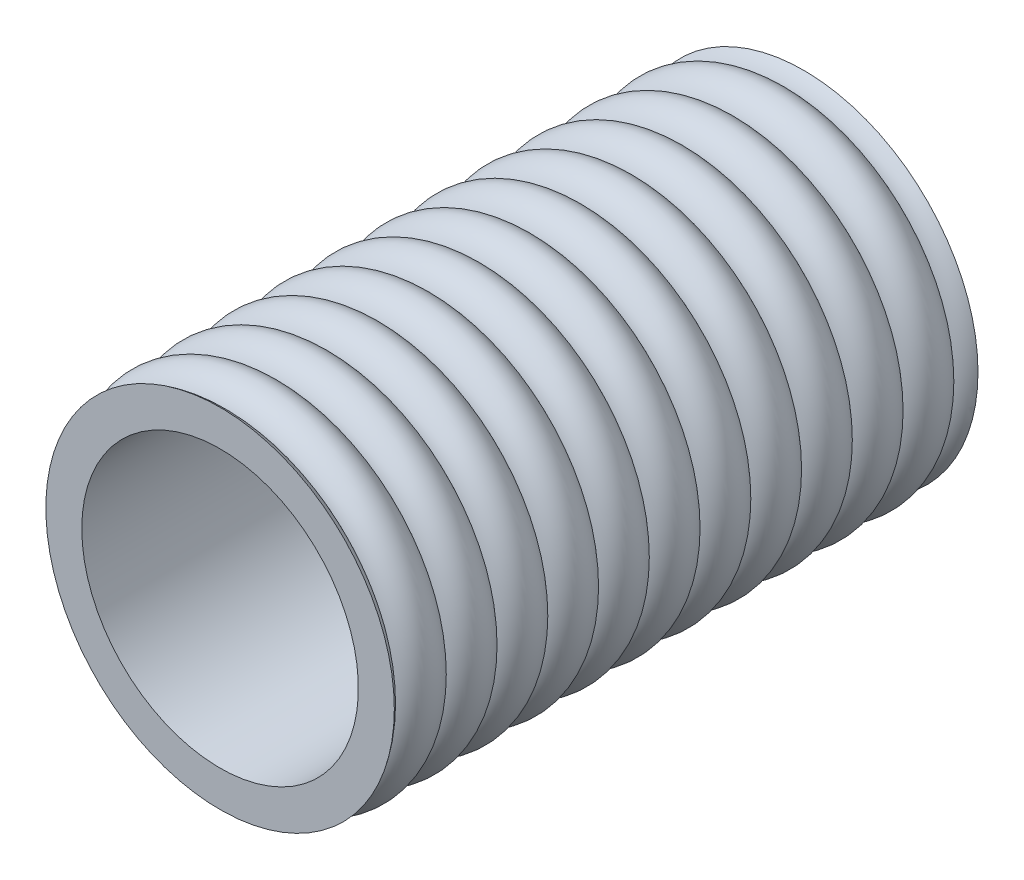
from build123d import *

# Parameters (mm, degrees)
SKETCH1_R           = 7
BOSS_EXTRUDE1_DEPTH = 23
SKETCH2_R           = 5.4
CUT_EXTRUDE1_DEPTH  = 2
SKETCH3_R           = 5.45
CUT_EXTRUDE2_DEPTH  = 26.039968051


with BuildPart() as part:
    # Sketch1 → Boss-Extrude1 (new body)
    with BuildSketch(Plane.XY):
        Circle(SKETCH1_R)
    extrude(amount=BOSS_EXTRUDE1_DEPTH)

    # Sketch2 → Cut-Extrude1 (cut)
    with BuildSketch(Plane.XY.offset(23)):
        Circle(SKETCH2_R)
    extrude(amount=-CUT_EXTRUDE1_DEPTH, mode=Mode.SUBTRACT)

    # Sketch3 → Cut-Extrude2 (cut, through all)
    with BuildSketch(Plane(origin=(0, 0, 0), x_dir=(-1, 0, 0), z_dir=(0, 0, -1))):
        Circle(SKETCH3_R)
    extrude(amount=-CUT_EXTRUDE2_DEPTH, mode=Mode.SUBTRACT)

    # Sketch6 → Cut-Revolve1 (revolve, cut)
    with BuildSketch(Plane(origin=(0, 0, 0), x_dir=(1, 0, 0), z_dir=(0, 1, 0))):
        with BuildLine():
            Line((6.866025404, -23), (7.682640522, -23))
            Line((7.682640522, -23), (7.682640522, 0))
            Line((7.682640522, 0), (6.866025404, 0))
            ThreePointArc((6.866025404, 0), (6.5, -0.366025404), (6, -0.5))
            ThreePointArc((6, -0.5), (7, -1.5), (6, -2.5))
            ThreePointArc((6, -2.5), (7, -3.5), (6, -4.5))
            ThreePointArc((6, -4.5), (7, -5.5), (6, -6.5))
            ThreePointArc((6, -6.5), (7, -7.5), (6, -8.5))
            ThreePointArc((6, -8.5), (7, -9.5), (6, -10.5))
            ThreePointArc((6, -10.5), (7, -11.5), (6, -12.5))
            ThreePointArc((6, -12.5), (7, -13.5), (6, -14.5))
            ThreePointArc((6, -14.5), (7, -15.5), (6, -16.5))
            ThreePointArc((6, -16.5), (7, -17.5), (6, -18.5))
            ThreePointArc((6, -18.5), (7, -19.5), (6, -20.5))
            ThreePointArc((6, -20.5), (7, -21.5), (6, -22.5))
            ThreePointArc((6, -22.5), (6.5, -22.633974596), (6.866025404, -23))
        make_face()
    revolve(axis=Axis((0, 0, 23), (0, 0, -1)), mode=Mode.SUBTRACT)


solid = part.part
